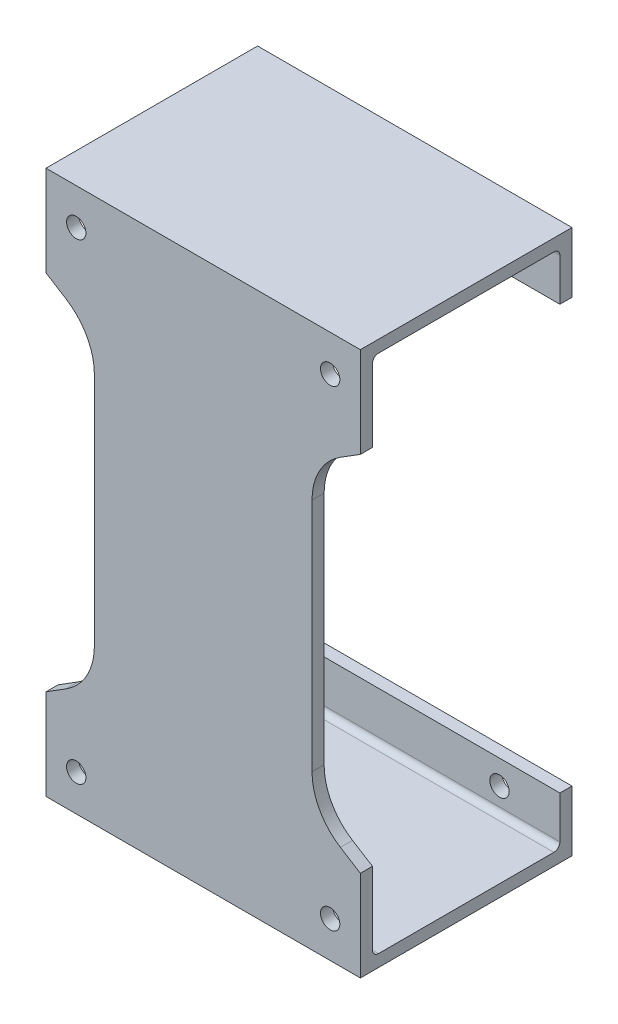
from build123d import *

# Parameters (mm, degrees)
BOSS_EXTRUDE1_DEPTH = 26
CUT_EXTRUDE1_REACH  = 64.658
SKETCH2_R           = 1.6
CUT_EXTRUDE5_REACH  = 63.563
SKETCH6_R           = 1.6
FILLET1_R           = 1
CUT_EXTRUDE6_REACH  = 64.658
FILLET2_R           = 10


with BuildPart() as part:
    # Sketch1 → Boss-Extrude1 (new, symmetric)
    with BuildSketch(Plane(origin=(0, 0, 0), x_dir=(0, 0, -1), z_dir=(1, 0, 0))):
        Polygon((0, -45), (0, 45), (35, 45), (35, 35), (33, 35), (33, 43), (2, 43), (2, -43), (33, -43), (33, -35), (35, -35), (35, -45), align=None)
    extrude(amount=BOSS_EXTRUDE1_DEPTH, both=True)

    # Sketch2 → Cut-Extrude1 (cut, up to next)
    with BuildSketch(Plane.XY, mode=Mode.PRIVATE) as cut_extrude1_sk1:
        with Locations((-21, -39)):
            Circle(SKETCH2_R)
    cut_extrude1_tool1 = extrude(cut_extrude1_sk1.sketch, amount=-CUT_EXTRUDE1_REACH, mode=Mode.PRIVATE) & part.part
    # Sketch2 → Cut-Extrude1 (cut, up to next)
    with BuildSketch(Plane.XY, mode=Mode.PRIVATE) as cut_extrude1_sk2:
        with Locations((-21, 39)):
            Circle(SKETCH2_R)
    cut_extrude1_tool2 = extrude(cut_extrude1_sk2.sketch, amount=-CUT_EXTRUDE1_REACH, mode=Mode.PRIVATE) & part.part
    # Sketch2 → Cut-Extrude1 (cut, up to next)
    with BuildSketch(Plane.XY, mode=Mode.PRIVATE) as cut_extrude1_sk3:
        with Locations((21, 39)):
            Circle(SKETCH2_R)
    cut_extrude1_tool3 = extrude(cut_extrude1_sk3.sketch, amount=-CUT_EXTRUDE1_REACH, mode=Mode.PRIVATE) & part.part
    # Sketch2 → Cut-Extrude1 (cut, up to next)
    with BuildSketch(Plane.XY, mode=Mode.PRIVATE) as cut_extrude1_sk4:
        with Locations((21, -39)):
            Circle(SKETCH2_R)
    cut_extrude1_tool4 = extrude(cut_extrude1_sk4.sketch, amount=-CUT_EXTRUDE1_REACH, mode=Mode.PRIVATE) & part.part
    add(cut_extrude1_tool1.solids().sort_by_distance((-21, -39, 0))[0], mode=Mode.SUBTRACT)
    add(cut_extrude1_tool2.solids().sort_by_distance((-21, 39, 0))[0], mode=Mode.SUBTRACT)
    add(cut_extrude1_tool3.solids().sort_by_distance((21, 39, 0))[0], mode=Mode.SUBTRACT)
    add(cut_extrude1_tool4.solids().sort_by_distance((21, -39, 0))[0], mode=Mode.SUBTRACT)

    # Sketch6 → Cut-Extrude5 (cut, up to next)
    with BuildSketch(Plane.XY.offset(-33), mode=Mode.PRIVATE) as cut_extrude5_sk1:
        with Locations((16, -39)):
            Circle(SKETCH6_R)
    cut_extrude5_tool1 = extrude(cut_extrude5_sk1.sketch, amount=-CUT_EXTRUDE5_REACH, mode=Mode.PRIVATE) & part.part
    # Sketch6 → Cut-Extrude5 (cut, up to next)
    with BuildSketch(Plane.XY.offset(-33), mode=Mode.PRIVATE) as cut_extrude5_sk2:
        with Locations((-16, -39)):
            Circle(SKETCH6_R)
    cut_extrude5_tool2 = extrude(cut_extrude5_sk2.sketch, amount=-CUT_EXTRUDE5_REACH, mode=Mode.PRIVATE) & part.part
    # Sketch6 → Cut-Extrude5 (cut, up to next)
    with BuildSketch(Plane.XY.offset(-33), mode=Mode.PRIVATE) as cut_extrude5_sk3:
        with Locations((-16, 39)):
            Circle(SKETCH6_R)
    cut_extrude5_tool3 = extrude(cut_extrude5_sk3.sketch, amount=-CUT_EXTRUDE5_REACH, mode=Mode.PRIVATE) & part.part
    # Sketch6 → Cut-Extrude5 (cut, up to next)
    with BuildSketch(Plane.XY.offset(-33), mode=Mode.PRIVATE) as cut_extrude5_sk4:
        with Locations((16, 39)):
            Circle(SKETCH6_R)
    cut_extrude5_tool4 = extrude(cut_extrude5_sk4.sketch, amount=-CUT_EXTRUDE5_REACH, mode=Mode.PRIVATE) & part.part
    add(cut_extrude5_tool1.solids().sort_by_distance((16, -39, -33))[0], mode=Mode.SUBTRACT)
    add(cut_extrude5_tool2.solids().sort_by_distance((-16, -39, -33))[0], mode=Mode.SUBTRACT)
    add(cut_extrude5_tool3.solids().sort_by_distance((-16, 39, -33))[0], mode=Mode.SUBTRACT)
    add(cut_extrude5_tool4.solids().sort_by_distance((16, 39, -33))[0], mode=Mode.SUBTRACT)

    # Fillet1
    fillet1_edges = [part.edges().sort_by_distance(p)[0] for p in [
        (0, 43, -33),
        (0, 43, -2),
        (0, -43, -2),
        (0, -43, -33),
    ]]
    fillet(fillet1_edges, radius=FILLET1_R)

    # Sketch7 → Cut-Extrude6 (cut, up to next)
    with BuildSketch(Plane.XY, mode=Mode.PRIVATE) as cut_extrude6_sk1:
        Polygon((-26, 30), (-18, 25), (-18, -25), (-26, -30), align=None)
    cut_extrude6_tool1 = extrude(cut_extrude6_sk1.sketch, amount=-CUT_EXTRUDE6_REACH, mode=Mode.PRIVATE) & part.part
    # Sketch7 → Cut-Extrude6 (cut, up to next)
    with BuildSketch(Plane.XY, mode=Mode.PRIVATE) as cut_extrude6_sk2:
        Polygon((26, -30), (18, -25), (18, 25), (26, 30), align=None)
    cut_extrude6_tool2 = extrude(cut_extrude6_sk2.sketch, amount=-CUT_EXTRUDE6_REACH, mode=Mode.PRIVATE) & part.part
    add(cut_extrude6_tool1.solids().sort_by_distance((-22.121212, 0, 0))[0], mode=Mode.SUBTRACT)
    add(cut_extrude6_tool2.solids().sort_by_distance((22.121212, 0, 0))[0], mode=Mode.SUBTRACT)

    # Fillet2
    fillet2_edges = [part.edges().sort_by_distance(p)[0] for p in [
        (18, -25, -1),
        (18, 25, -1),
        (-18, 25, -1),
        (-18, -25, -1),
    ]]
    fillet(fillet2_edges, radius=FILLET2_R)


solid = part.part
